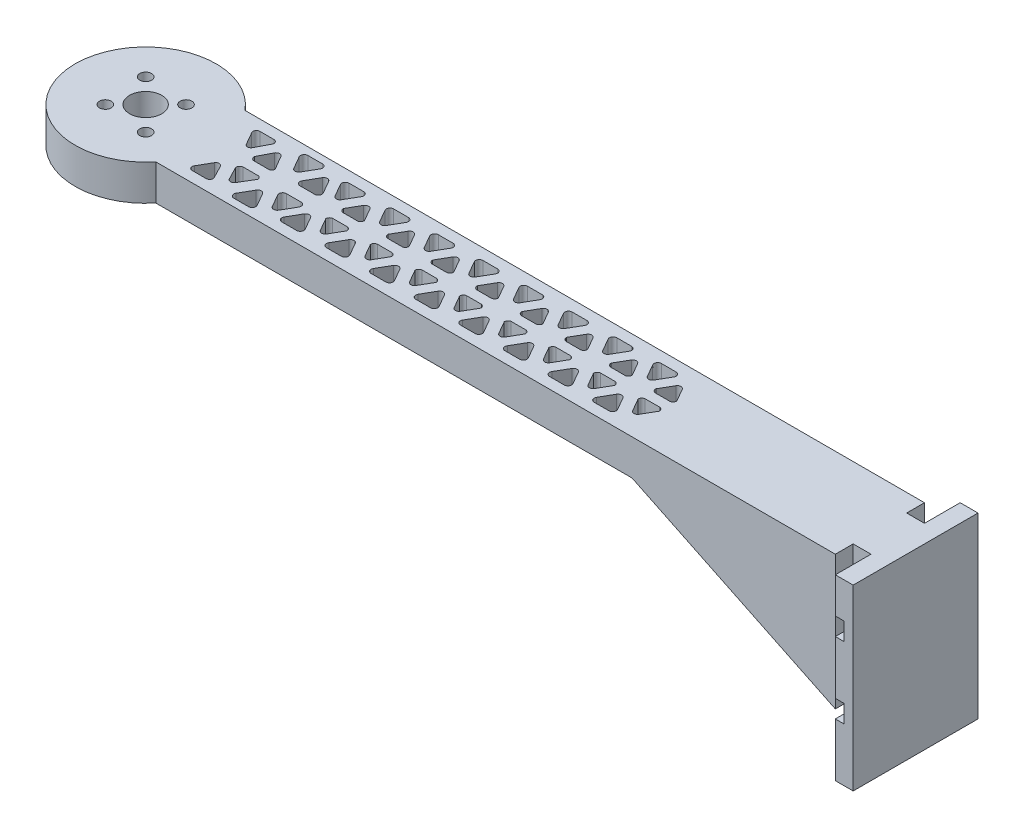
from build123d import *

# Parameters (mm, degrees)
SKETCH1_R           = 1.65
SKETCH1_R_2         = 4.5
BOSS_EXTRUDE1_DEPTH = 10
BOSS_EXTRUDE2_DEPTH = 50
BOSS_EXTRUDE3_DEPTH = 25
CUT_EXTRUDE1_REACH  = 224.387
SKETCH2_4_W         = 5
SKETCH2_4_H         = 5
CUT_EXTRUDE2_REACH  = 224.602
SKETCH4_W           = 2.5
SKETCH4_H           = 5


with BuildPart() as part:
    # Sketch1 → Boss-Extrude1 (new body)
    with BuildSketch(Plane(origin=(0, 0, 0), x_dir=(1, 0, 0), z_dir=(0, 1, 0))):
        with BuildLine():
            Line((215.781228136, 12.419661208), (15.251683783, 12.419661208))
            ThreePointArc((15.251683783, 12.419661208), (-19.862171776, -0.080338792), (15.251683783, -12.580338792))
            Line((15.251683783, -12.580338792), (215.781228136, -12.580338792))
            Line((215.781228136, -12.580338792), (215.781228136, 12.419661208))
        make_face()
        with BuildLine():
            ThreePointArc((40.028484267, -8.923117966), (40.028697604, -9.947176998), (39.141872006, -10.459268109))
            Line((39.141872006, -10.459268109), (35.007344818, -10.459268109))
            ThreePointArc((35.007344818, -10.459268109), (34.12051922, -9.947176998), (34.120732557, -8.923117966))
            Line((34.120732557, -8.923117966), (36.187996151, -5.34480815))
            ThreePointArc((36.187996151, -5.34480815), (37.074608412, -4.833086491), (37.961220673, -5.34480815))
            Line((37.961220673, -5.34480815), (40.028484267, -8.923117966))
        make_face(mode=Mode.SUBTRACT)
        with BuildLine():
            Line((21.614703637, -8.12452744), (23.681967231, -4.546217624))
            ThreePointArc((23.681967231, -4.546217624), (24.543612682, -4.061494427), (25.383043849, -4.583744154))
            Line((25.383043849, -4.583744154), (27.244871966, -8.162053969))
            ThreePointArc((27.244871966, -8.162053969), (27.213581729, -9.113447541), (26.384038862, -9.580338792))
            Line((26.384038862, -9.580338792), (22.454947151, -9.580338792))
            ThreePointArc((22.454947151, -9.580338792), (21.614501458, -9.095029425), (21.614703637, -8.12452744))
        make_face(mode=Mode.SUBTRACT)
        with BuildLine():
            ThreePointArc((27.803132488, -2.735420106), (28.041756396, -1.959117555), (28.760166912, -1.580338792))
            Line((28.760166912, -1.580338792), (33.170984506, -1.580338792))
            ThreePointArc((33.170984506, -1.580338792), (33.622927159, -1.975727629), (33.775469807, -2.556516089))
            Line((33.775469807, -2.556516089), (31.573625479, -6.255367121))
            ThreePointArc((31.573625479, -6.255367121), (30.697555502, -6.931576396), (29.718236674, -6.416122982))
            Line((29.718236674, -6.416122982), (27.803132488, -2.735420106))
        make_face(mode=Mode.SUBTRACT)
        with BuildLine():
            Line((46.634703637, -7.963849857), (48.701967231, -4.385540041))
            ThreePointArc((48.701967231, -4.385540041), (49.588579492, -3.873818381), (50.475191753, -4.385540041))
            Line((50.475191753, -4.385540041), (52.542455347, -7.963849857))
            ThreePointArc((52.542455347, -7.963849857), (52.542668684, -8.987908889), (51.655843086, -9.5))
            Line((51.655843086, -9.5), (47.521315898, -9.5))
            ThreePointArc((47.521315898, -9.5), (46.6344903, -8.987908889), (46.634703637, -7.963849857))
        make_face(mode=Mode.SUBTRACT)
        with BuildLine():
            Line((59.144703637, -7.963849857), (61.211967231, -4.385540041))
            ThreePointArc((61.211967231, -4.385540041), (62.098579492, -3.873818381), (62.985191753, -4.385540041))
            Line((62.985191753, -4.385540041), (65.052455347, -7.963849857))
            ThreePointArc((65.052455347, -7.963849857), (65.052668684, -8.987908889), (64.165843086, -9.5))
            Line((64.165843086, -9.5), (60.031315898, -9.5))
            ThreePointArc((60.031315898, -9.5), (59.1444903, -8.987908889), (59.144703637, -7.963849857))
        make_face(mode=Mode.SUBTRACT)
        with BuildLine():
            Line((71.654703637, -7.963849857), (73.721967231, -4.385540041))
            ThreePointArc((73.721967231, -4.385540041), (74.608579492, -3.873818381), (75.495191753, -4.385540041))
            Line((75.495191753, -4.385540041), (77.562455347, -7.963849857))
            ThreePointArc((77.562455347, -7.963849857), (77.562668684, -8.987908889), (76.675843086, -9.5))
            Line((76.675843086, -9.5), (72.541315898, -9.5))
            ThreePointArc((72.541315898, -9.5), (71.6544903, -8.987908889), (71.654703637, -7.963849857))
        make_face(mode=Mode.SUBTRACT)
        with BuildLine():
            Line((84.164703637, -7.963849857), (86.231967231, -4.385540041))
            ThreePointArc((86.231967231, -4.385540041), (87.118579492, -3.873818381), (88.005191753, -4.385540041))
            Line((88.005191753, -4.385540041), (90.072455347, -7.963849857))
            ThreePointArc((90.072455347, -7.963849857), (90.072668684, -8.987908889), (89.185843086, -9.5))
            Line((89.185843086, -9.5), (85.051315898, -9.5))
            ThreePointArc((85.051315898, -9.5), (84.1644903, -8.987908889), (84.164703637, -7.963849857))
        make_face(mode=Mode.SUBTRACT)
        with BuildLine():
            Line((46.281498727, -3.523632181), (44.214235133, -7.101941997))
            ThreePointArc((44.214235133, -7.101941997), (43.327622872, -7.613663657), (42.441010611, -7.101941997))
            Line((42.441010611, -7.101941997), (40.373261673, -3.514943175))
            ThreePointArc((40.373261673, -3.514943175), (40.373776477, -2.491304726), (41.260359278, -1.979634055))
            Line((41.260359278, -1.979634055), (45.394886466, -1.979634055))
            ThreePointArc((45.394886466, -1.979634055), (46.287424275, -2.493670166), (46.281498727, -3.523632181))
        make_face(mode=Mode.SUBTRACT)
        with BuildLine():
            ThreePointArc((52.887718097, -2.564364072), (53.123716588, -1.859495358), (53.774330358, -1.5))
            Line((53.774330358, -1.5), (57.908857546, -1.5))
            ThreePointArc((57.908857546, -1.5), (58.556731527, -1.85658781), (58.795469807, -2.556516089))
            Line((58.795469807, -2.556516089), (56.728206213, -6.142673887))
            ThreePointArc((56.728206213, -6.142673887), (55.841593952, -6.654395547), (54.954981691, -6.142673887))
            Line((54.954981691, -6.142673887), (52.887718097, -2.564364072))
        make_face(mode=Mode.SUBTRACT)
        with BuildLine():
            ThreePointArc((65.397718097, -2.564364072), (65.633716588, -1.859495358), (66.284330358, -1.5))
            Line((66.284330358, -1.5), (70.418857546, -1.5))
            ThreePointArc((70.418857546, -1.5), (71.066731527, -1.85658781), (71.305469807, -2.556516089))
            Line((71.305469807, -2.556516089), (69.238206213, -6.142673887))
            ThreePointArc((69.238206213, -6.142673887), (68.351593952, -6.654395547), (67.464981691, -6.142673887))
            Line((67.464981691, -6.142673887), (65.397718097, -2.564364072))
        make_face(mode=Mode.SUBTRACT)
        with BuildLine():
            ThreePointArc((77.907718097, -2.564364072), (78.143716588, -1.859495358), (78.794330358, -1.5))
            Line((78.794330358, -1.5), (82.928857546, -1.5))
            ThreePointArc((82.928857546, -1.5), (83.576731527, -1.85658781), (83.815469807, -2.556516089))
            Line((83.815469807, -2.556516089), (81.748206213, -6.142673887))
            ThreePointArc((81.748206213, -6.142673887), (80.861593952, -6.654395547), (79.974981691, -6.142673887))
            Line((79.974981691, -6.142673887), (77.907718097, -2.564364072))
        make_face(mode=Mode.SUBTRACT)
        with BuildLine():
            ThreePointArc((90.417718097, -2.564364072), (90.653716588, -1.859495358), (91.304330358, -1.5))
            Line((91.304330358, -1.5), (95.438857546, -1.5))
            ThreePointArc((95.438857546, -1.5), (96.086731527, -1.85658781), (96.325469807, -2.556516089))
            Line((96.325469807, -2.556516089), (94.258206213, -6.142673887))
            ThreePointArc((94.258206213, -6.142673887), (93.371593952, -6.654395547), (92.484981691, -6.142673887))
            Line((92.484981691, -6.142673887), (90.417718097, -2.564364072))
        make_face(mode=Mode.SUBTRACT)
        with BuildLine():
            Line((96.674703637, -7.963849857), (98.741967231, -4.385540041))
            ThreePointArc((98.741967231, -4.385540041), (99.628579492, -3.873818381), (100.515191753, -4.385540041))
            Line((100.515191753, -4.385540041), (102.582455347, -7.963849857))
            ThreePointArc((102.582455347, -7.963849857), (102.582668684, -8.987908889), (101.695843086, -9.5))
            Line((101.695843086, -9.5), (97.561315898, -9.5))
            ThreePointArc((97.561315898, -9.5), (96.6744903, -8.987908889), (96.674703637, -7.963849857))
        make_face(mode=Mode.SUBTRACT)
        with BuildLine():
            Line((109.184703637, -7.963849857), (111.251967231, -4.385540041))
            ThreePointArc((111.251967231, -4.385540041), (112.138579492, -3.873818381), (113.025191753, -4.385540041))
            Line((113.025191753, -4.385540041), (115.092455347, -7.963849857))
            ThreePointArc((115.092455347, -7.963849857), (115.092668684, -8.987908889), (114.205843086, -9.5))
            Line((114.205843086, -9.5), (110.071315898, -9.5))
            ThreePointArc((110.071315898, -9.5), (109.1844903, -8.987908889), (109.184703637, -7.963849857))
        make_face(mode=Mode.SUBTRACT)
        with BuildLine():
            Line((121.694703637, -7.963849857), (123.761967231, -4.385540041))
            ThreePointArc((123.761967231, -4.385540041), (124.648579492, -3.873818381), (125.535191753, -4.385540041))
            Line((125.535191753, -4.385540041), (127.602455347, -7.963849857))
            ThreePointArc((127.602455347, -7.963849857), (127.602668684, -8.987908889), (126.715843086, -9.5))
            Line((126.715843086, -9.5), (122.581315898, -9.5))
            ThreePointArc((122.581315898, -9.5), (121.6944903, -8.987908889), (121.694703637, -7.963849857))
        make_face(mode=Mode.SUBTRACT)
        with BuildLine():
            Line((134.204703637, -7.963849857), (136.271967231, -4.385540041))
            ThreePointArc((136.271967231, -4.385540041), (137.158579492, -3.873818381), (138.045191753, -4.385540041))
            Line((138.045191753, -4.385540041), (140.112455347, -7.963849857))
            ThreePointArc((140.112455347, -7.963849857), (140.112668684, -8.987908889), (139.225843086, -9.5))
            Line((139.225843086, -9.5), (135.091315898, -9.5))
            ThreePointArc((135.091315898, -9.5), (134.2044903, -8.987908889), (134.204703637, -7.963849857))
        make_face(mode=Mode.SUBTRACT)
        with BuildLine():
            ThreePointArc((102.927718097, -2.564364072), (103.163716588, -1.859495358), (103.814330358, -1.5))
            Line((103.814330358, -1.5), (107.948857546, -1.5))
            ThreePointArc((107.948857546, -1.5), (108.596731527, -1.85658781), (108.835469807, -2.556516089))
            Line((108.835469807, -2.556516089), (106.768206213, -6.142673887))
            ThreePointArc((106.768206213, -6.142673887), (105.881593952, -6.654395547), (104.994981691, -6.142673887))
            Line((104.994981691, -6.142673887), (102.927718097, -2.564364072))
        make_face(mode=Mode.SUBTRACT)
        with BuildLine():
            ThreePointArc((115.437718097, -2.564364072), (115.673716588, -1.859495358), (116.324330358, -1.5))
            Line((116.324330358, -1.5), (120.458857546, -1.5))
            ThreePointArc((120.458857546, -1.5), (121.106731527, -1.85658781), (121.345469807, -2.556516089))
            Line((121.345469807, -2.556516089), (119.278206213, -6.142673887))
            ThreePointArc((119.278206213, -6.142673887), (118.391593952, -6.654395547), (117.504981691, -6.142673887))
            Line((117.504981691, -6.142673887), (115.437718097, -2.564364072))
        make_face(mode=Mode.SUBTRACT)
        with BuildLine():
            ThreePointArc((127.947718097, -2.564364072), (128.183716588, -1.859495358), (128.834330358, -1.5))
            Line((128.834330358, -1.5), (132.968857546, -1.5))
            ThreePointArc((132.968857546, -1.5), (133.616731527, -1.85658781), (133.855469807, -2.556516089))
            Line((133.855469807, -2.556516089), (131.788206213, -6.142673887))
            ThreePointArc((131.788206213, -6.142673887), (130.901593952, -6.654395547), (130.014981691, -6.142673887))
            Line((130.014981691, -6.142673887), (127.947718097, -2.564364072))
        make_face(mode=Mode.SUBTRACT)
        with BuildLine():
            ThreePointArc((140.457718097, -2.564364072), (140.693716588, -1.859495358), (141.344330358, -1.5))
            Line((141.344330358, -1.5), (145.478857546, -1.5))
            ThreePointArc((145.478857546, -1.5), (146.126731527, -1.85658781), (146.365469807, -2.556516089))
            Line((146.365469807, -2.556516089), (144.298206213, -6.142673887))
            ThreePointArc((144.298206213, -6.142673887), (143.411593952, -6.654395547), (142.524981691, -6.142673887))
            Line((142.524981691, -6.142673887), (140.457718097, -2.564364072))
        make_face(mode=Mode.SUBTRACT)
        with BuildLine():
            Line((27.803132488, 2.574742523), (29.718236674, 6.255445399))
            ThreePointArc((29.718236674, 6.255445399), (30.697555502, 6.770898813), (31.573625479, 6.094689538))
            Line((31.573625479, 6.094689538), (33.775469807, 2.395838506))
            ThreePointArc((33.775469807, 2.395838506), (33.622927159, 1.815050046), (33.170984506, 1.419661208))
            Line((33.170984506, 1.419661208), (28.760166912, 1.419661208))
            ThreePointArc((28.760166912, 1.419661208), (28.041756396, 1.798439972), (27.803132488, 2.574742523))
        make_face(mode=Mode.SUBTRACT)
        with BuildLine():
            ThreePointArc((21.614703637, 7.963849857), (21.614501458, 8.934351842), (22.454947151, 9.419661208))
            Line((22.454947151, 9.419661208), (26.384038862, 9.419661208))
            ThreePointArc((26.384038862, 9.419661208), (27.213581729, 8.952769958), (27.244871966, 8.001376386))
            Line((27.244871966, 8.001376386), (25.383043849, 4.423066571))
            ThreePointArc((25.383043849, 4.423066571), (24.543612682, 3.900816844), (23.681967231, 4.385540041))
            Line((23.681967231, 4.385540041), (21.614703637, 7.963849857))
        make_face(mode=Mode.SUBTRACT)
        with BuildLine():
            Line((40.028484267, 8.762440383), (37.961220673, 5.184130567))
            ThreePointArc((37.961220673, 5.184130567), (37.074608412, 4.672408908), (36.187996151, 5.184130567))
            Line((36.187996151, 5.184130567), (34.120732557, 8.762440383))
            ThreePointArc((34.120732557, 8.762440383), (34.12051922, 9.786499415), (35.007344818, 10.298590526))
            Line((35.007344818, 10.298590526), (39.141872006, 10.298590526))
            ThreePointArc((39.141872006, 10.298590526), (40.028697604, 9.786499415), (40.028484267, 8.762440383))
        make_face(mode=Mode.SUBTRACT)
        with BuildLine():
            ThreePointArc((46.281498727, 3.362954598), (46.287424275, 2.332992583), (45.394886466, 1.818956472))
            Line((45.394886466, 1.818956472), (41.260359278, 1.818956472))
            ThreePointArc((41.260359278, 1.818956472), (40.373776477, 2.330627143), (40.373261673, 3.354265592))
            Line((40.373261673, 3.354265592), (42.441010611, 6.941264414))
            ThreePointArc((42.441010611, 6.941264414), (43.327622872, 7.452986074), (44.214235133, 6.941264414))
            Line((44.214235133, 6.941264414), (46.281498727, 3.362954598))
        make_face(mode=Mode.SUBTRACT)
        with BuildLine():
            Line((52.887718097, 2.403686489), (54.954981691, 5.981996304))
            ThreePointArc((54.954981691, 5.981996304), (55.841593952, 6.493717964), (56.728206213, 5.981996304))
            Line((56.728206213, 5.981996304), (58.795469807, 2.395838506))
            ThreePointArc((58.795469807, 2.395838506), (58.556731527, 1.695910227), (57.908857546, 1.339322417))
            Line((57.908857546, 1.339322417), (53.774330358, 1.339322417))
            ThreePointArc((53.774330358, 1.339322417), (53.123716588, 1.698817775), (52.887718097, 2.403686489))
        make_face(mode=Mode.SUBTRACT)
        with BuildLine():
            Line((65.397718097, 2.403686489), (67.464981691, 5.981996304))
            ThreePointArc((67.464981691, 5.981996304), (68.351593952, 6.493717964), (69.238206213, 5.981996304))
            Line((69.238206213, 5.981996304), (71.305469807, 2.395838506))
            ThreePointArc((71.305469807, 2.395838506), (71.066731527, 1.695910227), (70.418857546, 1.339322417))
            Line((70.418857546, 1.339322417), (66.284330358, 1.339322417))
            ThreePointArc((66.284330358, 1.339322417), (65.633716588, 1.698817775), (65.397718097, 2.403686489))
        make_face(mode=Mode.SUBTRACT)
        with BuildLine():
            Line((77.907718097, 2.403686489), (79.974981691, 5.981996304))
            ThreePointArc((79.974981691, 5.981996304), (80.861593952, 6.493717964), (81.748206213, 5.981996304))
            Line((81.748206213, 5.981996304), (83.815469807, 2.395838506))
            ThreePointArc((83.815469807, 2.395838506), (83.576731527, 1.695910227), (82.928857546, 1.339322417))
            Line((82.928857546, 1.339322417), (78.794330358, 1.339322417))
            ThreePointArc((78.794330358, 1.339322417), (78.143716588, 1.698817775), (77.907718097, 2.403686489))
        make_face(mode=Mode.SUBTRACT)
        with BuildLine():
            Line((90.417718097, 2.403686489), (92.484981691, 5.981996304))
            ThreePointArc((92.484981691, 5.981996304), (93.371593952, 6.493717964), (94.258206213, 5.981996304))
            Line((94.258206213, 5.981996304), (96.325469807, 2.395838506))
            ThreePointArc((96.325469807, 2.395838506), (96.086731527, 1.695910227), (95.438857546, 1.339322417))
            Line((95.438857546, 1.339322417), (91.304330358, 1.339322417))
            ThreePointArc((91.304330358, 1.339322417), (90.653716588, 1.698817775), (90.417718097, 2.403686489))
        make_face(mode=Mode.SUBTRACT)
        with BuildLine():
            ThreePointArc((46.634703637, 7.803172274), (46.6344903, 8.827231306), (47.521315898, 9.339322417))
            Line((47.521315898, 9.339322417), (51.655843086, 9.339322417))
            ThreePointArc((51.655843086, 9.339322417), (52.542668684, 8.827231306), (52.542455347, 7.803172274))
            Line((52.542455347, 7.803172274), (50.475191753, 4.224862458))
            ThreePointArc((50.475191753, 4.224862458), (49.588579492, 3.713140798), (48.701967231, 4.224862458))
            Line((48.701967231, 4.224862458), (46.634703637, 7.803172274))
        make_face(mode=Mode.SUBTRACT)
        with BuildLine():
            ThreePointArc((59.144703637, 7.803172274), (59.1444903, 8.827231306), (60.031315898, 9.339322417))
            Line((60.031315898, 9.339322417), (64.165843086, 9.339322417))
            ThreePointArc((64.165843086, 9.339322417), (65.052668684, 8.827231306), (65.052455347, 7.803172274))
            Line((65.052455347, 7.803172274), (62.985191753, 4.224862458))
            ThreePointArc((62.985191753, 4.224862458), (62.098579492, 3.713140798), (61.211967231, 4.224862458))
            Line((61.211967231, 4.224862458), (59.144703637, 7.803172274))
        make_face(mode=Mode.SUBTRACT)
        with BuildLine():
            ThreePointArc((71.654703637, 7.803172274), (71.6544903, 8.827231306), (72.541315898, 9.339322417))
            Line((72.541315898, 9.339322417), (76.675843086, 9.339322417))
            ThreePointArc((76.675843086, 9.339322417), (77.562668684, 8.827231306), (77.562455347, 7.803172274))
            Line((77.562455347, 7.803172274), (75.495191753, 4.224862458))
            ThreePointArc((75.495191753, 4.224862458), (74.608579492, 3.713140798), (73.721967231, 4.224862458))
            Line((73.721967231, 4.224862458), (71.654703637, 7.803172274))
        make_face(mode=Mode.SUBTRACT)
        with BuildLine():
            ThreePointArc((84.164703637, 7.803172274), (84.1644903, 8.827231306), (85.051315898, 9.339322417))
            Line((85.051315898, 9.339322417), (89.185843086, 9.339322417))
            ThreePointArc((89.185843086, 9.339322417), (90.072668684, 8.827231306), (90.072455347, 7.803172274))
            Line((90.072455347, 7.803172274), (88.005191753, 4.224862458))
            ThreePointArc((88.005191753, 4.224862458), (87.118579492, 3.713140798), (86.231967231, 4.224862458))
            Line((86.231967231, 4.224862458), (84.164703637, 7.803172274))
        make_face(mode=Mode.SUBTRACT)
        with BuildLine():
            Line((102.927718097, 2.403686489), (104.994981691, 5.981996304))
            ThreePointArc((104.994981691, 5.981996304), (105.881593952, 6.493717964), (106.768206213, 5.981996304))
            Line((106.768206213, 5.981996304), (108.835469807, 2.395838506))
            ThreePointArc((108.835469807, 2.395838506), (108.596731527, 1.695910227), (107.948857546, 1.339322417))
            Line((107.948857546, 1.339322417), (103.814330358, 1.339322417))
            ThreePointArc((103.814330358, 1.339322417), (103.163716588, 1.698817775), (102.927718097, 2.403686489))
        make_face(mode=Mode.SUBTRACT)
        with BuildLine():
            Line((115.437718097, 2.403686489), (117.504981691, 5.981996304))
            ThreePointArc((117.504981691, 5.981996304), (118.391593952, 6.493717964), (119.278206213, 5.981996304))
            Line((119.278206213, 5.981996304), (121.345469807, 2.395838506))
            ThreePointArc((121.345469807, 2.395838506), (121.106731527, 1.695910227), (120.458857546, 1.339322417))
            Line((120.458857546, 1.339322417), (116.324330358, 1.339322417))
            ThreePointArc((116.324330358, 1.339322417), (115.673716588, 1.698817775), (115.437718097, 2.403686489))
        make_face(mode=Mode.SUBTRACT)
        with BuildLine():
            Line((127.947718097, 2.403686489), (130.014981691, 5.981996304))
            ThreePointArc((130.014981691, 5.981996304), (130.901593952, 6.493717964), (131.788206213, 5.981996304))
            Line((131.788206213, 5.981996304), (133.855469807, 2.395838506))
            ThreePointArc((133.855469807, 2.395838506), (133.616731527, 1.695910227), (132.968857546, 1.339322417))
            Line((132.968857546, 1.339322417), (128.834330358, 1.339322417))
            ThreePointArc((128.834330358, 1.339322417), (128.183716588, 1.698817775), (127.947718097, 2.403686489))
        make_face(mode=Mode.SUBTRACT)
        with BuildLine():
            Line((140.457718097, 2.403686489), (142.524981691, 5.981996304))
            ThreePointArc((142.524981691, 5.981996304), (143.411593952, 6.493717964), (144.298206213, 5.981996304))
            Line((144.298206213, 5.981996304), (146.365469807, 2.395838506))
            ThreePointArc((146.365469807, 2.395838506), (146.126731527, 1.695910227), (145.478857546, 1.339322417))
            Line((145.478857546, 1.339322417), (141.344330358, 1.339322417))
            ThreePointArc((141.344330358, 1.339322417), (140.693716588, 1.698817775), (140.457718097, 2.403686489))
        make_face(mode=Mode.SUBTRACT)
        with BuildLine():
            ThreePointArc((96.674703637, 7.803172274), (96.6744903, 8.827231306), (97.561315898, 9.339322417))
            Line((97.561315898, 9.339322417), (101.695843086, 9.339322417))
            ThreePointArc((101.695843086, 9.339322417), (102.582668684, 8.827231306), (102.582455347, 7.803172274))
            Line((102.582455347, 7.803172274), (100.515191753, 4.224862458))
            ThreePointArc((100.515191753, 4.224862458), (99.628579492, 3.713140798), (98.741967231, 4.224862458))
            Line((98.741967231, 4.224862458), (96.674703637, 7.803172274))
        make_face(mode=Mode.SUBTRACT)
        with BuildLine():
            ThreePointArc((109.184703637, 7.803172274), (109.1844903, 8.827231306), (110.071315898, 9.339322417))
            Line((110.071315898, 9.339322417), (114.205843086, 9.339322417))
            ThreePointArc((114.205843086, 9.339322417), (115.092668684, 8.827231306), (115.092455347, 7.803172274))
            Line((115.092455347, 7.803172274), (113.025191753, 4.224862458))
            ThreePointArc((113.025191753, 4.224862458), (112.138579492, 3.713140798), (111.251967231, 4.224862458))
            Line((111.251967231, 4.224862458), (109.184703637, 7.803172274))
        make_face(mode=Mode.SUBTRACT)
        with BuildLine():
            ThreePointArc((121.694703637, 7.803172274), (121.6944903, 8.827231306), (122.581315898, 9.339322417))
            Line((122.581315898, 9.339322417), (126.715843086, 9.339322417))
            ThreePointArc((126.715843086, 9.339322417), (127.602668684, 8.827231306), (127.602455347, 7.803172274))
            Line((127.602455347, 7.803172274), (125.535191753, 4.224862458))
            ThreePointArc((125.535191753, 4.224862458), (124.648579492, 3.713140798), (123.761967231, 4.224862458))
            Line((123.761967231, 4.224862458), (121.694703637, 7.803172274))
        make_face(mode=Mode.SUBTRACT)
        with BuildLine():
            ThreePointArc((134.204703637, 7.803172274), (134.2044903, 8.827231306), (135.091315898, 9.339322417))
            Line((135.091315898, 9.339322417), (139.225843086, 9.339322417))
            ThreePointArc((139.225843086, 9.339322417), (140.112668684, 8.827231306), (140.112455347, 7.803172274))
            Line((140.112455347, 7.803172274), (138.045191753, 4.224862458))
            ThreePointArc((138.045191753, 4.224862458), (137.158579492, 3.713140798), (136.271967231, 4.224862458))
            Line((136.271967231, 4.224862458), (134.204703637, 7.803172274))
        make_face(mode=Mode.SUBTRACT)
        with Locations(Location((-6.797853213, 6.63717563, 0), (0, 0, 270))):
            Circle(SKETCH1_R, mode=Mode.SUBTRACT)
        with Locations(Location((5.576515458, 5.576515458, 0), (0, 0, 270))):
            Circle(SKETCH1_R, mode=Mode.SUBTRACT)
        with Locations(Location((-5.737193041, -5.737193041, 0), (0, 0, 270))):
            Circle(SKETCH1_R, mode=Mode.SUBTRACT)
        with Locations(Location((6.63717563, -6.797853213, 0), (0, 0, 270))):
            Circle(SKETCH1_R, mode=Mode.SUBTRACT)
        with Locations(Location((-0.080338792, -0.080338792, 0), (0, 0, 270))):
            Circle(SKETCH1_R_2, mode=Mode.SUBTRACT)
    extrude(amount=BOSS_EXTRUDE1_DEPTH)

    # Sketch2 → Boss-Extrude2 (add)
    with BuildSketch(Plane(origin=(0, 10, 0), x_dir=(1, 0, 0), z_dir=(0, 1, 0))):
        Polygon((215.781228136, -17.580338792), (215.781228136, -12.580338792), (215.781228136, 12.419661208), (215.781228136, 17.419661208), (210.781228136, 17.419661208), (210.781228136, -12.580338792), (210.781228136, -17.580338792), align=None)
    extrude(amount=-BOSS_EXTRUDE2_DEPTH)

    # Sketch3 → Boss-Extrude3 (add)
    with BuildSketch(Plane.XY.offset(12.580338792)):
        Polygon((210.781228136, 0), (148.781228136, 0), (210.781228136, -30), align=None)
    extrude(amount=-BOSS_EXTRUDE3_DEPTH)

    # Cut-Extrude1: up to this plane
    cut_extrude1_end = Plane(origin=(210.781228136, -30, -81.296362639), z_dir=(-0.43556092810428065, -0.9001592514155136, 0))
    # Sketch2<4> → Cut-Extrude1 (cut, up to the surface)
    with BuildSketch(Plane(origin=(0, 10, 0), x_dir=(1, 0, 0), z_dir=(0, 1, 0)), mode=Mode.PRIVATE) as cut_extrude1_sk1:
        with Locations((208.281228136, 9.919661208)):
            Rectangle(SKETCH2_4_W, SKETCH2_4_H)
    cut_extrude1_tool1 = split(extrude(cut_extrude1_sk1.sketch, amount=-CUT_EXTRUDE1_REACH, mode=Mode.PRIVATE), bisect_by=cut_extrude1_end, keep=Keep.BOTH, mode=Mode.PRIVATE)
    add(cut_extrude1_tool1.solids().sort_by_distance((208.281228, 10, -9.919661))[0], mode=Mode.SUBTRACT)
    # Sketch2<4> → Cut-Extrude1 (cut, up to the surface)
    with BuildSketch(Plane(origin=(0, 10, 0), x_dir=(1, 0, 0), z_dir=(0, 1, 0)), mode=Mode.PRIVATE) as cut_extrude1_sk2:
        with Locations((208.281228136, -10.080338792)):
            Rectangle(SKETCH2_4_W, SKETCH2_4_H)
    cut_extrude1_tool2 = split(extrude(cut_extrude1_sk2.sketch, amount=-CUT_EXTRUDE1_REACH, mode=Mode.PRIVATE), bisect_by=cut_extrude1_end, keep=Keep.BOTH, mode=Mode.PRIVATE)
    add(cut_extrude1_tool2.solids().sort_by_distance((208.281228, 10, 10.080339))[0], mode=Mode.SUBTRACT)

    # Cut-Extrude2: up to this face of the body (flat: up to its plane)
    cut_extrude2_end = Plane(part.part.faces().sort_by_distance((213.281228136, -15, -17.419661208))[0])
    # Sketch4 → Cut-Extrude2 (cut, up to the picked face)
    with BuildSketch(Plane.XY.offset(17.580338792), mode=Mode.PRIVATE) as cut_extrude2_sk1:
        with Locations((209.531228136, -22.5)):
            Rectangle(SKETCH4_W, SKETCH4_H)
    cut_extrude2_tool1 = split(extrude(cut_extrude2_sk1.sketch, amount=-CUT_EXTRUDE2_REACH, mode=Mode.PRIVATE), bisect_by=cut_extrude2_end, keep=Keep.BOTH, mode=Mode.PRIVATE)
    # Sketch4 → Cut-Extrude2 (cut, up to the picked face)
    with BuildSketch(Plane.XY.offset(17.580338792), mode=Mode.PRIVATE) as cut_extrude2_sk2:
        with Locations((212.031228136, -22.5)):
            Rectangle(SKETCH4_W, SKETCH4_H)
    cut_extrude2_tool2 = split(extrude(cut_extrude2_sk2.sketch, amount=-CUT_EXTRUDE2_REACH, mode=Mode.PRIVATE), bisect_by=cut_extrude2_end, keep=Keep.BOTH, mode=Mode.PRIVATE)
    # Sketch4 → Cut-Extrude2 (cut, up to the picked face)
    with BuildSketch(Plane.XY.offset(17.580338792), mode=Mode.PRIVATE) as cut_extrude2_sk3:
        with Locations((209.531228136, -2.5)):
            Rectangle(SKETCH4_W, SKETCH4_H)
    cut_extrude2_tool3 = split(extrude(cut_extrude2_sk3.sketch, amount=-CUT_EXTRUDE2_REACH, mode=Mode.PRIVATE), bisect_by=cut_extrude2_end, keep=Keep.BOTH, mode=Mode.PRIVATE)
    # Sketch4 → Cut-Extrude2 (cut, up to the picked face)
    with BuildSketch(Plane.XY.offset(17.580338792), mode=Mode.PRIVATE) as cut_extrude2_sk4:
        with Locations((212.031228136, -2.5)):
            Rectangle(SKETCH4_W, SKETCH4_H)
    cut_extrude2_tool4 = split(extrude(cut_extrude2_sk4.sketch, amount=-CUT_EXTRUDE2_REACH, mode=Mode.PRIVATE), bisect_by=cut_extrude2_end, keep=Keep.BOTH, mode=Mode.PRIVATE)
    add(cut_extrude2_tool1.solids().sort_by(Axis((209.531228, -22.5, 17.580339), (0, 0, -1)))[0], mode=Mode.SUBTRACT)
    add(cut_extrude2_tool2.solids().sort_by(Axis((212.031228, -22.5, 17.580339), (0, 0, -1)))[0], mode=Mode.SUBTRACT)
    add(cut_extrude2_tool3.solids().sort_by(Axis((209.531228, -2.5, 17.580339), (0, 0, -1)))[0], mode=Mode.SUBTRACT)
    add(cut_extrude2_tool4.solids().sort_by(Axis((212.031228, -2.5, 17.580339), (0, 0, -1)))[0], mode=Mode.SUBTRACT)


solid = part.part
